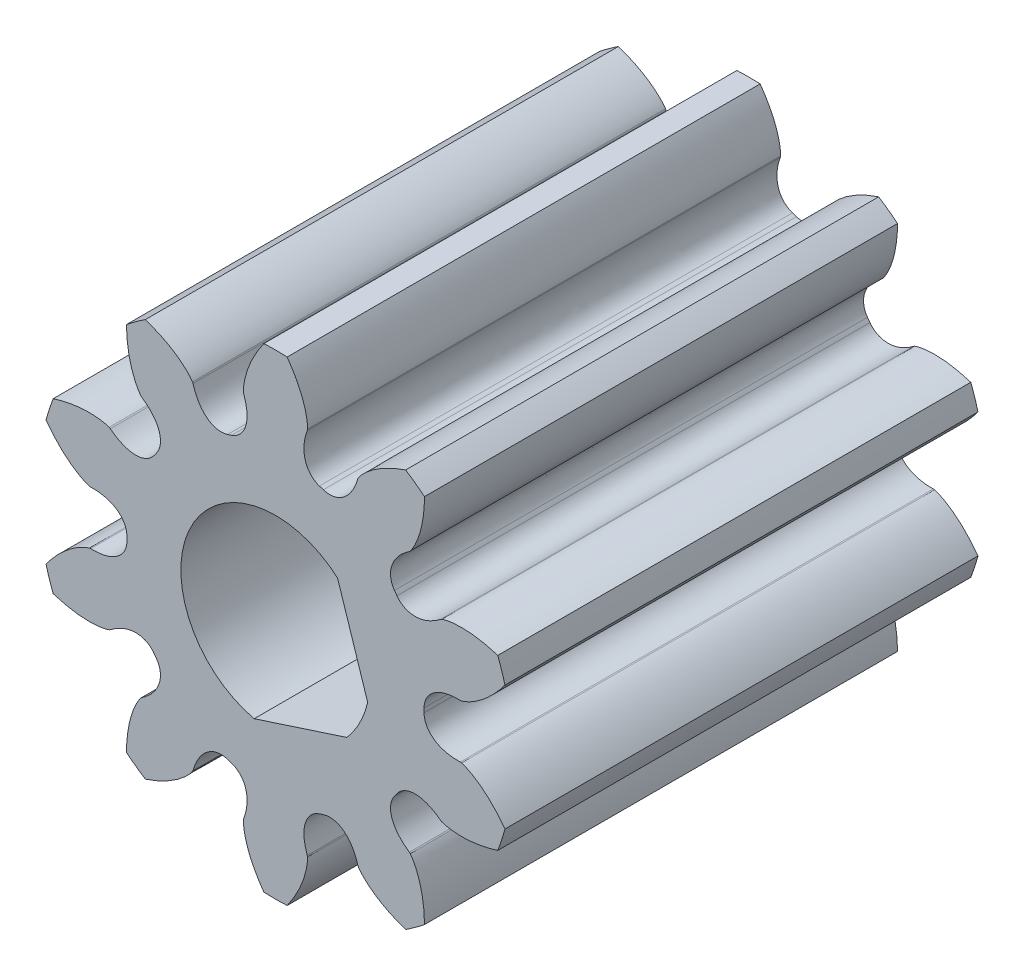
from build123d import *

# Parameters (mm, degrees)
TOOTH_DEPTH        = 36
TEETH_COUNT        = 10
SKETCH6_OUTSIDE_W  = 51.256
SKETCH6_OUTSIDE_H  = 53.132
SKETCH6_OUTSIDE_R  = 18.0975
ADDENDUM_DEPTH     = 45.673263637
CUT_EXTRUDE4_DEPTH = 25
SKETCH8_R          = 1.5
CUT_EXTRUDE5_DEPTH = 48.388654731


with BuildPart() as part:
    # Sketch1 (on Front Plane) → Tooth (new body)
    with BuildSketch(Plane.XY):
        with BuildLine():
            Line((2.436124396, 14.098104533), (2.417590679, 14.001093153))
            add(Edge.make_bspline(
                [(2.417590679, 14.001093153), (2.332608198, 13.767004937), (2.232443301, 13.412842527), (2.168573653, 12.935613688), (2.158855191, 12.590097865), (2.190545281, 12.247795513), (2.271630496, 11.907051407), (2.415325346, 11.56974929), (2.723013466, 11.125959752), (3.080922801, 10.885502364), (3.356525232, 10.801437196)],
                knots=[0, 0, 0, 0, 0.20012551, 0.294348356, 0.386167986, 0.477231396, 0.569745357, 0.666449872, 0.770112617, 1, 1, 1, 1], degree=3))
            ThreePointArc((3.356525232, 10.801437196), (0, -11.3109375), (-3.356525232, 10.801437196))
            add(Edge.make_bspline(
                [(-2.417590679, 14.001093153), (-2.332608198, 13.767004937), (-2.232443301, 13.412842527), (-2.168573653, 12.935613688), (-2.158855191, 12.590097865), (-2.190545281, 12.247795513), (-2.271630496, 11.907051407), (-2.415325346, 11.56974929), (-2.723013466, 11.125959752), (-3.080922801, 10.885502364), (-3.356525232, 10.801437196)],
                knots=[0, 0, 0, 0, 0.20012551, 0.294348356, 0.386167986, 0.477231396, 0.569745357, 0.666449872, 0.770112617, 1, 1, 1, 1], degree=3))
            Line((-2.417590679, 14.001093153), (-2.436124396, 14.098104533))
            add(Edge.make_bspline(
                [(0, 19.167462634), (-0.409119221, 18.717969311), (-0.950260641, 18.03335738), (-1.525253348, 17.090702469), (-1.843313115, 16.465689422), (-2.079979297, 15.896169681), (-2.245871517, 15.390516225), (-2.352474732, 14.955759776), (-2.422177671, 14.53380354), (-2.440679834, 14.255512212), (-2.436124396, 14.098104533)],
                knots=[0, 0, 0, 0, 0.317753817, 0.454551878, 0.576630709, 0.683990311, 0.776630686, 0.854551835, 0.917753763, 1, 1, 1, 1], degree=3))
            add(Edge.make_bspline(
                [(0, 19.167462634), (0.409119221, 18.717969311), (0.950260641, 18.03335738), (1.525253348, 17.090702469), (1.843313115, 16.465689422), (2.079979297, 15.896169681), (2.245871517, 15.390516225), (2.352474732, 14.955759776), (2.422177671, 14.53380354), (2.440679834, 14.255512212), (2.436124396, 14.098104533)],
                knots=[0, 0, 0, 0, 0.317753817, 0.454551878, 0.576630709, 0.683990311, 0.776630686, 0.854551835, 0.917753763, 1, 1, 1, 1], degree=3))
        make_face()
    tooth = extrude(amount=TOOTH_DEPTH)

    # Teeth: Tooth ×10 about axis
    teeth_axis = Axis((0, 0, 36), (0, 0, -1))
    for i in range(1, TEETH_COUNT):
        add(tooth.rotate(teeth_axis, i * 360 / TEETH_COUNT))

    # Sketch6 outside → Addendum (cut, through all)
    with BuildSketch(Plane.XY):
        Rectangle(SKETCH6_OUTSIDE_W, SKETCH6_OUTSIDE_H)
        Circle(SKETCH6_OUTSIDE_R, mode=Mode.SUBTRACT)
    extrude(amount=ADDENDUM_DEPTH, mode=Mode.SUBTRACT)

    # Sketch7 → Cut-Extrude4 (cut)
    with BuildSketch(Plane.XY.offset(36)):
        with BuildLine():
            Line((-1.619980528, -7.015387594), (5.434133145, -4.723367122))
            ThreePointArc((5.434133145, -4.723367122), (6.415246974, -3.268731598), (7.015387594, -1.619980528))
            Line((7.015387594, -1.619980528), (4.723367122, 5.434133145))
            ThreePointArc((4.723367122, 5.434133145), (-6.415246974, 3.268731598), (-1.619980528, -7.015387594))
        make_face()
    extrude(amount=-CUT_EXTRUDE4_DEPTH, mode=Mode.SUBTRACT)

    # Sketch8 → Cut-Extrude5 (cut, through all)
    with BuildSketch(Plane(origin=(1.907076308, -5.869377358, 0), x_dir=(0.951056516294793, 0.3090169943760573, 0), z_dir=(-0.3090169943760573, 0.951056516294793, 0))):
        with Locations(Location((0, -23.5, 0), (0, 0, 180))):
            Circle(SKETCH8_R)
    extrude(amount=-CUT_EXTRUDE5_DEPTH, mode=Mode.SUBTRACT)


solid = part.part
